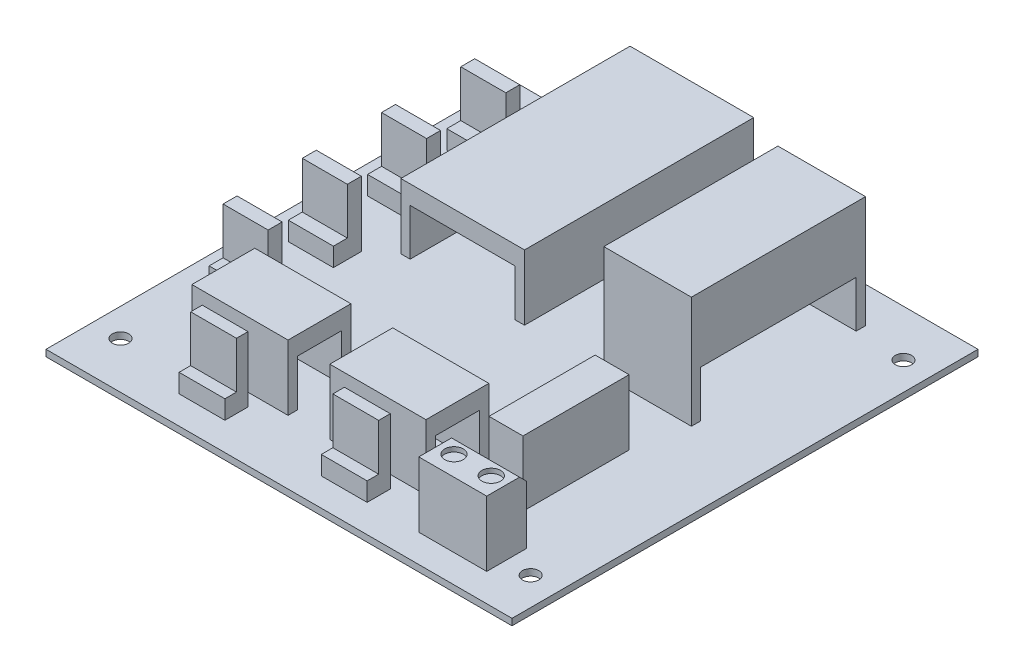
from build123d import *

# Parameters (mm, degrees)
ESBO_O1_W                = 100
ESBO_O1_H                = 100
RESSALTO_EXTRUS_O1_DEPTH = 1.4
ESBO_O2_W                = 88
ESBO_O2_H                = 88
RESSALTO_EXTRUS_O2_DEPTH = 24
ESBO_O4_W                = 100
ESBO_O4_H                = 100
ESBO_O4_W_2              = 14.578639588
ESBO_O4_H_2              = 8.540496419
ESBO_O4_W_3              = 7.289319794
ESBO_O4_H_3              = 22.779124356
ESBO_O4_W_4              = 18.794478339
ESBO_O4_H_4              = 37.364152615
ESBO_O4_W_5              = 26.546651383
ESBO_O4_H_5              = 38.188932231
ESBO_O4_W_6              = 20.632673902
ESBO_O4_H_6              = 13.495583341
ESBO_O4_W_7              = 9.670550534
ESBO_O4_H_7              = 6
ESBO_O4_W_8              = 9.833990962
ESBO_O4_H_8              = 4.968111267
CORTE_EXTRUS_O1_DEPTH    = 24
ESBO_O5_W                = 26.546651383
ESBO_O5_H                = 38.188932231
ESBO_O5_W_2              = 7.289319794
ESBO_O5_H_2              = 22.779124356
ESBO_O5_W_3              = 20.632673902
ESBO_O5_H_3              = 13.495583341
ESBO_O5_W_4              = 14.578639588
ESBO_O5_H_4              = 8.540496419
ESBO_O5_W_5              = 9.670550534
ESBO_O5_H_5              = 6
ESBO_O5_W_6              = 9.833990962
ESBO_O5_H_6              = 4.968111267
CORTE_EXTRUS_O2_DEPTH    = 10
ESBO_O6_R                = 2
CORTE_EXTRUS_O3_DEPTH    = 1
CHANFRO1_SIZE            = 1.5
CORTE_EXTRUS_O4_REACH    = 102.636
ESBO_O7_W                = 33.364152615
ESBO_O7_H                = 10
CORTE_EXTRUS_O5_REACH    = 111.458
ESBO_O8_W                = 22.546651383
ESBO_O8_H                = 10.000703343
CORTE_EXTRUS_O6_REACH    = 101.657
ESBO_O9_W                = 9.495583341
ESBO_O9_H                = 10
ESBO_O10_W               = 3
ESBO_O10_H               = 10
CORTE_EXTRUS_O7_DEPTH    = 9.670550534
CORTE_EXTRUS_O8_REACH    = 97.616
ESBO_O11_W               = 2.484055633
ESBO_O11_H               = 10
ESBO_O12_R               = 1.75
CORTE_EXTRUS_O9_DEPTH    = 1.4
RESSALTO_EXTRUS_O3_DEPTH = 11


with BuildPart() as part:
    # Esboço1 → Ressalto-extrusão1 (new body)
    with BuildSketch(Plane(origin=(0, 0, 0), x_dir=(1, 0, 0), z_dir=(0, 1, 0))):
        Rectangle(ESBO_O1_W, ESBO_O1_H)
    extrude(amount=RESSALTO_EXTRUS_O1_DEPTH)

    # Esboço2 → Ressalto-extrusão2 (add)
    with BuildSketch(Plane(origin=(0, 1.4, 0), x_dir=(1, 0, 0), z_dir=(0, 1, 0))):
        Rectangle(ESBO_O2_W, ESBO_O2_H)
    extrude(amount=RESSALTO_EXTRUS_O2_DEPTH)

    # Esboço4 → Corte-extrusão1 (cut)
    with BuildSketch(Plane(origin=(0, 25.4, 0), x_dir=(1, 0, 0), z_dir=(0, 1, 0))):
        Rectangle(ESBO_O4_W, ESBO_O4_H)
        with Locations((31.283330783, -39.729751791)):
            Rectangle(ESBO_O4_W_2, ESBO_O4_H_2, mode=Mode.SUBTRACT)
        with Locations((27.638670886, -17.539925754)):
            Rectangle(ESBO_O4_W_3, ESBO_O4_H_3, mode=Mode.SUBTRACT)
        with Locations((24.164004049, 23.617553252)):
            Rectangle(ESBO_O4_W_4, ESBO_O4_H_4, mode=Mode.SUBTRACT)
        with Locations((-16.396734338, 24.905533884)):
            Rectangle(ESBO_O4_W_5, ESBO_O4_H_5, mode=Mode.SUBTRACT)
        with Locations((-22.063064097, -29.56405701)):
            Rectangle(ESBO_O4_W_6, ESBO_O4_H_6, mode=Mode.SUBTRACT)
        with Locations((7.531276247, -29.56405701)):
            Rectangle(ESBO_O4_W_6, ESBO_O4_H_6, mode=Mode.SUBTRACT)
        with Locations((-39.164724733, 33)):
            Rectangle(ESBO_O4_W_7, ESBO_O4_H_7, mode=Mode.SUBTRACT)
        with Locations((-39.164724733, 16)):
            Rectangle(ESBO_O4_W_7, ESBO_O4_H_7, mode=Mode.SUBTRACT)
        with Locations((-39.164724733, -1)):
            Rectangle(ESBO_O4_W_7, ESBO_O4_H_7, mode=Mode.SUBTRACT)
        with Locations((-39.164724733, -18)):
            Rectangle(ESBO_O4_W_7, ESBO_O4_H_7, mode=Mode.SUBTRACT)
        with Locations((-22.524725577, -41.515944367)):
            Rectangle(ESBO_O4_W_8, ESBO_O4_H_8, mode=Mode.SUBTRACT)
        with Locations((7.992937727, -41.515944367)):
            Rectangle(ESBO_O4_W_8, ESBO_O4_H_8, mode=Mode.SUBTRACT)
    extrude(amount=-CORTE_EXTRUS_O1_DEPTH, mode=Mode.SUBTRACT)

    # Esboço5 → Corte-extrusão2 (cut)
    with BuildSketch(Plane(origin=(0, 25.4, 0), x_dir=(1, 0, 0), z_dir=(0, 1, 0))):
        with Locations((-16.396734338, 24.905533884)):
            Rectangle(ESBO_O5_W, ESBO_O5_H)
        with Locations((27.638670886, -17.539925754)):
            Rectangle(ESBO_O5_W_2, ESBO_O5_H_2)
        with Locations((7.531276247, -29.56405701)):
            Rectangle(ESBO_O5_W_3, ESBO_O5_H_3)
        with Locations((-22.063064097, -29.56405701)):
            Rectangle(ESBO_O5_W_3, ESBO_O5_H_3)
        with Locations((31.283330783, -39.729751791)):
            Rectangle(ESBO_O5_W_4, ESBO_O5_H_4)
        with Locations((-39.164724733, -18)):
            Rectangle(ESBO_O5_W_5, ESBO_O5_H_5)
        with Locations((-39.164724733, -1)):
            Rectangle(ESBO_O5_W_5, ESBO_O5_H_5)
        with Locations((-39.164724733, 16)):
            Rectangle(ESBO_O5_W_5, ESBO_O5_H_5)
        with Locations((-39.164724733, 33)):
            Rectangle(ESBO_O5_W_5, ESBO_O5_H_5)
        with Locations((7.992937727, -41.515944367)):
            Rectangle(ESBO_O5_W_6, ESBO_O5_H_6)
        with Locations((-22.524725577, -41.515944367)):
            Rectangle(ESBO_O5_W_6, ESBO_O5_H_6)
    extrude(amount=-CORTE_EXTRUS_O2_DEPTH, mode=Mode.SUBTRACT)

    # Esboço6 → Corte-extrusão3 (cut)
    with BuildSketch(Plane(origin=(0, 15.4, 0), x_dir=(1, 0, 0), z_dir=(0, 1, 0))):
        with Locations(Location((27.283330783, -39.729751791, 0), (0, 0, 270))):
            Circle(ESBO_O6_R)
        with Locations(Location((35.283330783, -39.729751791, 0), (0, 0, 270))):
            Circle(ESBO_O6_R)
    extrude(amount=-CORTE_EXTRUS_O3_DEPTH, mode=Mode.SUBTRACT)

    # Chanfro1
    chanfro1_edges = [part.edges().sort_by_distance(p)[0] for p in [
        (31.283330783, 15.4, 35.459503581),
    ]]
    chamfer(chanfro1_edges, length=CHANFRO1_SIZE)

    # Esboço7 → Corte-extrusão4 (cut, up to next)
    with BuildSketch(Plane(origin=(33.561243218, 0, 0), x_dir=(0, 0, -1), z_dir=(1, 0, 0)), mode=Mode.PRIVATE) as corte_extrus_o4_sk1:
        with Locations((23.617553252, 6.4)):
            Rectangle(ESBO_O7_W, ESBO_O7_H)
    corte_extrus_o4_tool1 = extrude(corte_extrus_o4_sk1.sketch, amount=-CORTE_EXTRUS_O4_REACH, mode=Mode.PRIVATE) & part.part
    add(corte_extrus_o4_tool1.solids().sort_by_distance((33.561243, 6.4, -23.617553))[0], mode=Mode.SUBTRACT)

    # Esboço8 → Corte-extrusão5 (cut, up to next)
    with BuildSketch(Plane(origin=(0, 0, -44), x_dir=(-1, 0, 0), z_dir=(0, 0, -1)), mode=Mode.PRIVATE) as corte_extrus_o5_sk1:
        with Locations((16.396734338, 6.400351672)):
            Rectangle(ESBO_O8_W, ESBO_O8_H)
    corte_extrus_o5_tool1 = extrude(corte_extrus_o5_sk1.sketch, amount=-CORTE_EXTRUS_O5_REACH, mode=Mode.PRIVATE) & part.part
    add(corte_extrus_o5_tool1.solids().sort_by_distance((-16.396734, 6.400352, -44))[0], mode=Mode.SUBTRACT)

    # Corte-extrusão6: up to this face of the body (flat: up to its plane)
    corte_extrus_o6_end = Plane(part.part.faces().sort_by_distance((17.847613198, 8.4, 29.56405701))[0])
    # Esboço9 → Corte-extrusão6 (cut, up to the picked face)
    with BuildSketch(Plane.ZY.offset(32.379401048), mode=Mode.PRIVATE) as corte_extrus_o6_sk1:
        with Locations((29.56405701, 6.4)):
            Rectangle(ESBO_O9_W, ESBO_O9_H)
    corte_extrus_o6_tool1 = split(extrude(corte_extrus_o6_sk1.sketch, amount=-CORTE_EXTRUS_O6_REACH, mode=Mode.PRIVATE), bisect_by=corte_extrus_o6_end, keep=Keep.BOTH, mode=Mode.PRIVATE)
    add(corte_extrus_o6_tool1.solids().sort_by(Axis((-32.379401, 6.4, 29.564057), (1, 0, 0)))[0], mode=Mode.SUBTRACT)

    # Esboço10 → Corte-extrusão7 (cut)
    with BuildSketch(Plane.ZY.offset(34.329449466)):
        with Locations((-31.5, 10.4)):
            Rectangle(ESBO_O10_W, ESBO_O10_H)
        with Locations((-14.5, 10.4)):
            Rectangle(ESBO_O10_W, ESBO_O10_H)
        with Locations((2.5, 10.4)):
            Rectangle(ESBO_O10_W, ESBO_O10_H)
        with Locations((19.5, 10.4)):
            Rectangle(ESBO_O10_W, ESBO_O10_H)
    extrude(amount=CORTE_EXTRUS_O7_DEPTH, mode=Mode.SUBTRACT)

    # Corte-extrusão8: up to this face of the body (flat: up to its plane)
    corte_extrus_o8_end = Plane(part.part.faces().sort_by_distance((12.909933208, 8.4, 41.515944367))[0])
    # Esboço11 → Corte-extrusão8 (cut, up to the picked face)
    with BuildSketch(Plane.ZY.offset(27.441721058), mode=Mode.PRIVATE) as corte_extrus_o8_sk1:
        with Locations((42.757972184, 10.4)):
            Rectangle(ESBO_O11_W, ESBO_O11_H)
    corte_extrus_o8_tool1 = split(extrude(corte_extrus_o8_sk1.sketch, amount=-CORTE_EXTRUS_O8_REACH, mode=Mode.PRIVATE), bisect_by=corte_extrus_o8_end, keep=Keep.BOTH, mode=Mode.PRIVATE)
    add(corte_extrus_o8_tool1.solids().sort_by(Axis((-27.441721, 10.4, 42.757972), (1, 0, 0)))[0], mode=Mode.SUBTRACT)

    # Esboço12 → Corte-extrusão9 (cut)
    with BuildSketch(Plane.XZ):
        with Locations(Location((-44, 40, 0), (0, 0, 270))):
            Circle(ESBO_O12_R)
        with Locations(Location((44, 40, 0), (0, 0, 270))):
            Circle(ESBO_O12_R)
        with Locations(Location((44, -40, 0), (0, 0, 270))):
            Circle(ESBO_O12_R)
        with Locations(Location((-44, -40, 0), (0, 0, 270))):
            Circle(ESBO_O12_R)
    extrude(amount=-CORTE_EXTRUS_O9_DEPTH, mode=Mode.SUBTRACT)

    # Esboço13 → Ressalto-extrusão3 (add)
    with BuildSketch(Plane(origin=(0, 0, -44), x_dir=(-1, 0, 0), z_dir=(0, 0, -1))):
        Polygon((5.123408647, 11.400703343), (27.67006003, 11.400703343), (27.67006003, 1.4), (29.67006003, 1.4), (29.67006003, 15.4), (3.123408647, 15.4), (3.123408647, 1.4), (5.123408647, 1.4), align=None)
    extrude(amount=RESSALTO_EXTRUS_O3_DEPTH)


solid = part.part
